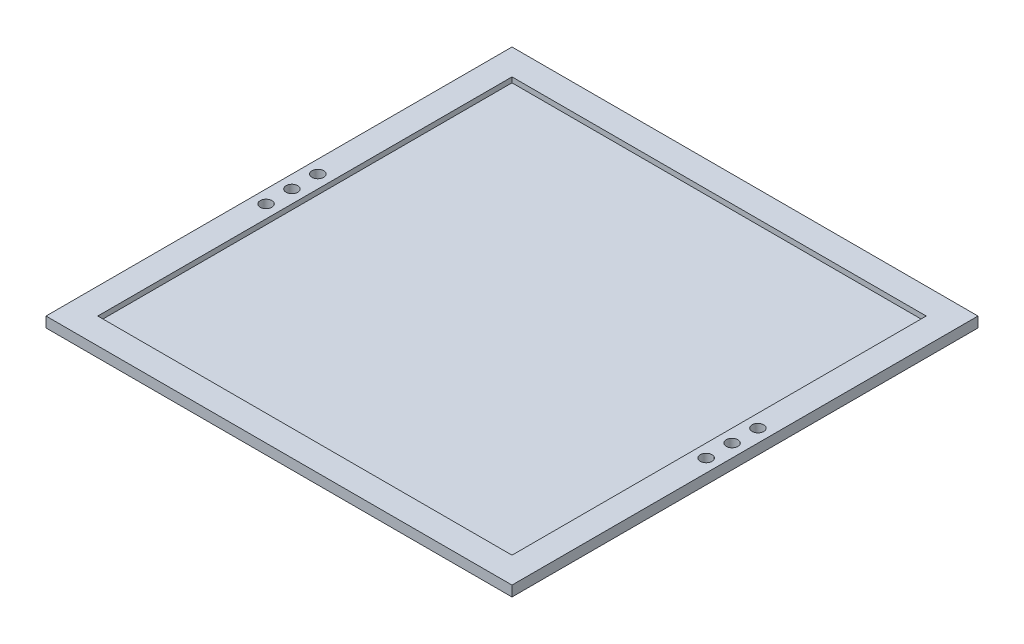
from build123d import *

# Parameters (mm, degrees)
EXTRUDE_1_DEPTH          = 2
EXTRUDE_2_DEPTH          = 4
CUT_EXTRUDE_1_DEPTH      = 128.342059038
CUT_EXTRUDE_1_DEPTH_BACK = 128.342059038
SKETCH_3_R               = 2.25


with BuildPart() as part:
    # 草图2 → 凸台-拉伸1 (new body)
    with BuildSketch(Plane(origin=(0, 0, 0), x_dir=(1, 0, 0), z_dir=(0, 1, 0))):
        Polygon((-80, 90), (-90, 90), (-90, -90), (90, -90), (90, 90), align=None)
    extrude(amount=EXTRUDE_1_DEPTH)

    # 草图2<3> → 凸台-拉伸2 (add)
    with BuildSketch(Plane(origin=(0, 0, 0), x_dir=(1, 0, 0), z_dir=(0, 1, 0))):
        Polygon((80, 90), (-80, 90), (-90, 90), (-90, -90), (-80, -90), (90, -90), (90, -80), (90, 90), align=None)
        Polygon((-80, 80), (0, 80), (80, 80), (80, -80), (-80, -80), align=None, mode=Mode.SUBTRACT)
    extrude(amount=EXTRUDE_2_DEPTH)

    # 草图3 → 切除-拉伸1 (cut, two sides: drawn at the far end of the back side and taken through both)
    with BuildSketch(Plane(origin=(0, 4, 0), x_dir=(1, 0, 0), z_dir=(0, 1, 0)).offset(-CUT_EXTRUDE_1_DEPTH_BACK)):
        with Locations((-85, -10)):
            Circle(SKETCH_3_R)
        with Locations((-85, 10)):
            Circle(SKETCH_3_R)
        with Locations((-85, 0)):
            Circle(SKETCH_3_R)
        with Locations((85, 0)):
            Circle(SKETCH_3_R)
        with Locations((85, -10)):
            Circle(SKETCH_3_R)
        with Locations((85, 10)):
            Circle(SKETCH_3_R)
    extrude(amount=CUT_EXTRUDE_1_DEPTH + CUT_EXTRUDE_1_DEPTH_BACK, mode=Mode.SUBTRACT)


solid = part.part
